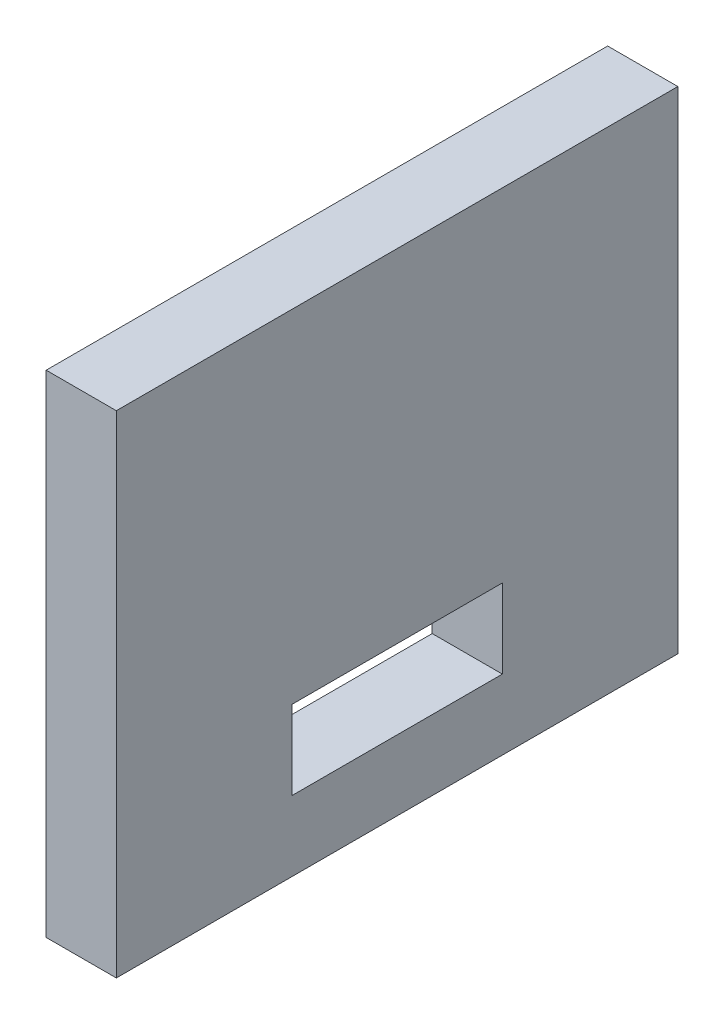
from build123d import *

# Parameters (mm, degrees)
SKETCH1_W           = 25.4
SKETCH1_H           = 22.225
SKETCH1_W_2         = 9.525
SKETCH1_H_2         = 3.571875
BOSS_EXTRUDE1_DEPTH = 3.175


with BuildPart() as part:
    # Sketch1 → Boss-Extrude1 (new body)
    with BuildSketch(Plane(origin=(0, 0, 0), x_dir=(0, 0, -1), z_dir=(1, 0, 0))):
        with Locations((12.7, 11.1125)):
            Rectangle(SKETCH1_W, SKETCH1_H)
        with Locations((12.7, 4.9609375)):
            Rectangle(SKETCH1_W_2, SKETCH1_H_2, mode=Mode.SUBTRACT)
    extrude(amount=BOSS_EXTRUDE1_DEPTH)


solid = part.part
